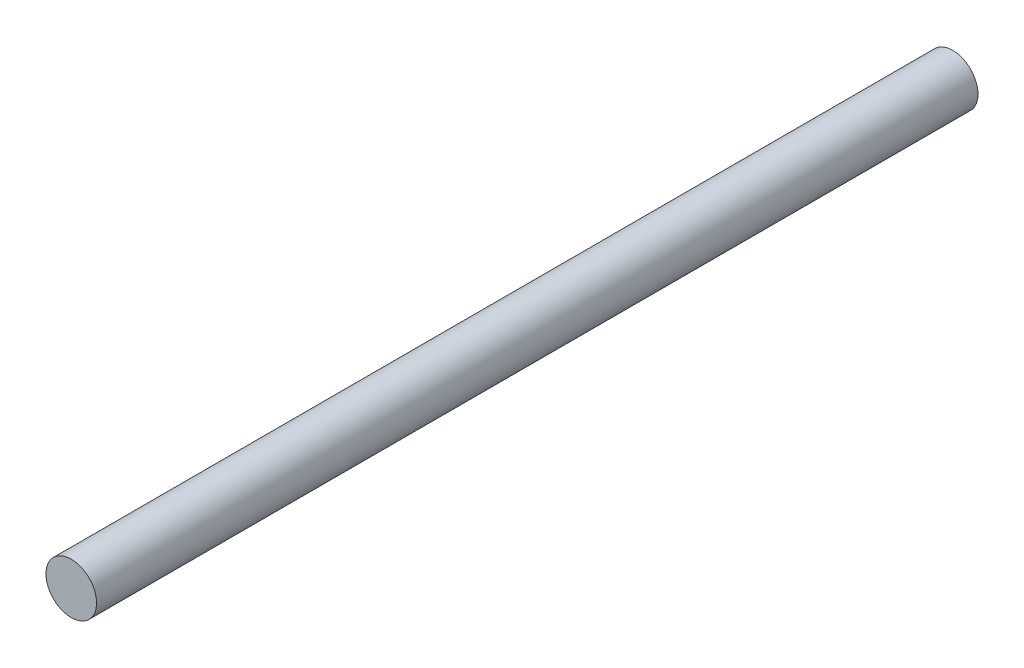
from build123d import *

# Parameters (mm, degrees)
SKETCH_1_R      = 3
EXTRUDE_1_DEPTH = 104.5


with BuildPart() as part:
    # ｽｹｯﾁ1 → ﾎﾞｽ - 押し出し1 (new body)
    with BuildSketch(Plane.XY):
        Circle(SKETCH_1_R)
    extrude(amount=EXTRUDE_1_DEPTH)


solid = part.part
